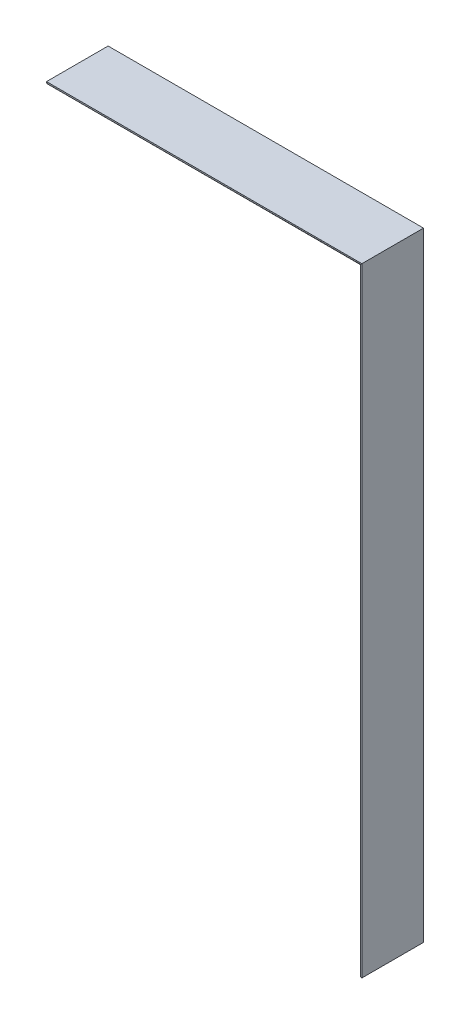
from build123d import *

# Parameters (mm, degrees)
HIERRO_ANGULAR_2_X_2_X_0_125_1_DEPTH        = 582.842048969
HIERRO_ANGULAR_2_X_2_X_0_125_1_2_DEPTH      = 260
HIERRO_ANGULAR_2_X_2_X_0_125_1_2_DEPTH_BACK = 72.842048969


with BuildPart() as part:
    # Sketch1 on segment 1 (carried to segment 1) → Hierro angular 2 X 2 X 0.125(1) (new body)
    with BuildSketch(Plane(origin=(0, -510, 0), x_dir=(-1, 0, 0), z_dir=(0, 1, 0))):
        with BuildLine():
            Line((0, 0), (0, 50.8))
            Line((0, 50.8), (0.00508, 50.8))
            ThreePointArc((0.00508, 50.8), (2.246551928, 49.871551928), (3.175, 47.63008))
            Line((3.175, 47.63008), (3.175, 7.9375))
            ThreePointArc((3.175, 7.9375), (4.569903955, 4.569903955), (7.9375, 3.175))
            Line((7.9375, 3.175), (47.63008, 3.175))
            ThreePointArc((47.63008, 3.175), (49.871551928, 2.246551928), (50.8, 0.00508))
            Line((50.8, 0.00508), (50.8, 0))
            Line((50.8, 0), (0, 0))
        make_face()
    extrude(amount=HIERRO_ANGULAR_2_X_2_X_0_125_1_DEPTH)

    # Hierro angular 2 X 2 X 0.125(1) mitre 1
    split(bisect_by=Plane(origin=(0, 0, 0), x_dir=(0.707106781, 0.707106781, 0), z_dir=(0.707106781, -0.707106781, 0)), keep=Keep.TOP)


with BuildPart() as body_2:
    # Sketch1 → Hierro angular 2 X 2 X 0.125_1 2 (new, two sides: drawn at the far end of the back side and taken through both)
    with BuildSketch(Plane(origin=(0, 0, 0), x_dir=(0, -1, 0), z_dir=(-1, 0, 0)).offset(-HIERRO_ANGULAR_2_X_2_X_0_125_1_2_DEPTH_BACK)):
        with BuildLine():
            Line((0, 0), (0, 50.8))
            Line((0, 50.8), (0.00508, 50.8))
            ThreePointArc((0.00508, 50.8), (2.246551928, 49.871551928), (3.175, 47.63008))
            Line((3.175, 47.63008), (3.175, 7.9375))
            ThreePointArc((3.175, 7.9375), (4.569903955, 4.569903955), (7.9375, 3.175))
            Line((7.9375, 3.175), (47.63008, 3.175))
            ThreePointArc((47.63008, 3.175), (49.871551928, 2.246551928), (50.8, 0.00508))
            Line((50.8, 0.00508), (50.8, 0))
            Line((50.8, 0), (0, 0))
        make_face()
    extrude(amount=HIERRO_ANGULAR_2_X_2_X_0_125_1_2_DEPTH + HIERRO_ANGULAR_2_X_2_X_0_125_1_2_DEPTH_BACK)

    # Hierro angular 2 X 2 X 0.125_1 2 mitre 1
    split(bisect_by=Plane(origin=(0, 0, 0), x_dir=(-0.707106781, -0.707106781, 0), z_dir=(-0.707106781, 0.707106781, 0)), keep=Keep.TOP)


solid = Compound([part.part, body_2.part])
